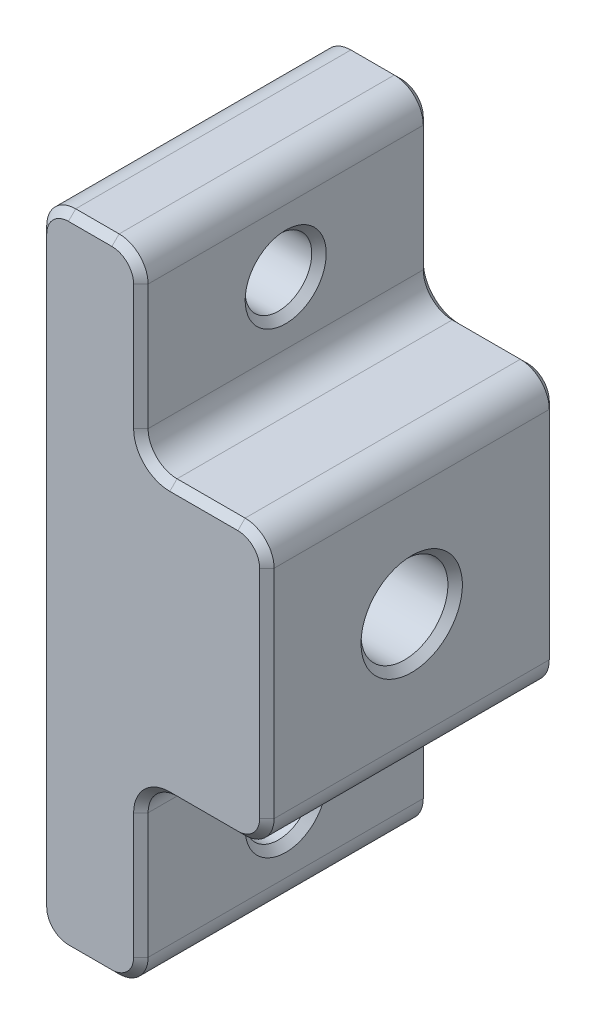
from build123d import *

# Parameters (mm, degrees)
AUFSATZ_LINEAR_AUSTRAGEN1_DEPTH = 20
SKIZZE2_R                       = 3
SCHNITT_LINEAR_AUSTRAGEN1_DEPTH = 20
SKIZZE3_R                       = 5.25
SCHNITT_LINEAR_AUSTRAGEN2_DEPTH = 6.2
SKIZZE4_R                       = 2.3
SCHNITT_LINEAR_AUSTRAGEN3_DEPTH = 10
VERRUNDUNG1_R                   = 2
FASE1_SIZE                      = 0.5


with BuildPart() as part:
    # Skizze1 → Aufsatz-Linear austragen1 (new body)
    with BuildSketch(Plane.XY):
        Polygon((0, -22.130332374), (0, 22.130332374), (7, 22.130332374), (7, 9.485781443), (15.7, 9.485781443), (15.7, -9.485781443), (7, -9.485781443), (7, -22.130332374), align=None)
    extrude(amount=AUFSATZ_LINEAR_AUSTRAGEN1_DEPTH)

    # Skizze2 → Schnitt-Linear austragen1 (cut)
    with BuildSketch(Plane(origin=(15.7, 0, 0), x_dir=(0, 0, -1), z_dir=(1, 0, 0))):
        with Locations((-10, 0)):
            Circle(SKIZZE2_R)
    extrude(amount=-SCHNITT_LINEAR_AUSTRAGEN1_DEPTH, mode=Mode.SUBTRACT)

    # Skizze3 → Schnitt-Linear austragen2 (cut)
    with BuildSketch(Plane.ZY):
        with Locations((10, 0)):
            Circle(SKIZZE3_R)
    extrude(amount=-SCHNITT_LINEAR_AUSTRAGEN2_DEPTH, mode=Mode.SUBTRACT)

    # Skizze4 → Schnitt-Linear austragen3 (cut)
    with BuildSketch(Plane(origin=(7, 0, 0), x_dir=(0, 0, -1), z_dir=(1, 0, 0))):
        with Locations((-10, -15.808056909)):
            Circle(SKIZZE4_R)
        with Locations((-10, 15.808056909)):
            Circle(SKIZZE4_R)
    extrude(amount=-SCHNITT_LINEAR_AUSTRAGEN3_DEPTH, mode=Mode.SUBTRACT)

    # Verrundung1
    verrundung1_edges = [part.edges().sort_by_distance(p)[0] for p in [
        (7, -9.485781443, 10),
        (7, -22.130332374, 10),
        (0, -22.130332374, 10),
        (0, 22.130332374, 10),
        (7, 22.130332374, 10),
        (7, 9.485781443, 10),
        (15.7, 9.485781443, 10),
        (15.7, -9.485781443, 10),
    ]]
    fillet(verrundung1_edges, radius=VERRUNDUNG1_R)

    # Fase1
    fase1_edges = [part.edges().sort_by_distance(p)[0] for p in [
        (15.7, 0, 13),
        (0, 0, 4.75),
        (6.2, 0, 13),
        (0, -15.808056909, 12.3),
        (7, -15.808056909, 12.3),
        (0, 15.808056909, 12.3),
        (7, 15.808056909, 12.3),
        (0, 0, 0),
        (0, 0, 20),
        (11.35, -9.485781443, 0),
        (7, -15.808056909, 0),
        (3.5, -22.130332374, 0),
        (3.5, 22.130332374, 0),
        (7, 15.808056909, 0),
        (11.35, 9.485781443, 0),
        (15.7, 0, 0),
        (0.585786438, -21.544545937, 0),
        (6.414213562, -21.544545937, 0),
        (15.114213562, -8.899995006, 0),
        (15.114213562, 8.899995006, 0),
        (6.414213562, 21.544545937, 0),
        (0.585786438, 21.544545937, 0),
        (3.5, 22.130332374, 20),
        (11.35, -9.485781443, 20),
        (15.7, 0, 20),
        (11.35, 9.485781443, 20),
        (7, 15.808056909, 20),
        (3.5, -22.130332374, 20),
        (7, -15.808056909, 20),
        (0.585786438, -21.544545937, 20),
        (6.414213562, -21.544545937, 20),
        (15.114213562, -8.899995006, 20),
        (15.114213562, 8.899995006, 20),
        (6.414213562, 21.544545937, 20),
        (0.585786438, 21.544545937, 20),
        (7.585786438, -10.071567881, 0),
        (7.585786438, -10.071567881, 20),
        (7.585786438, 10.071567881, 0),
        (7.585786438, 10.071567881, 20),
    ]]
    chamfer(fase1_edges, length=FASE1_SIZE)


solid = part.part
